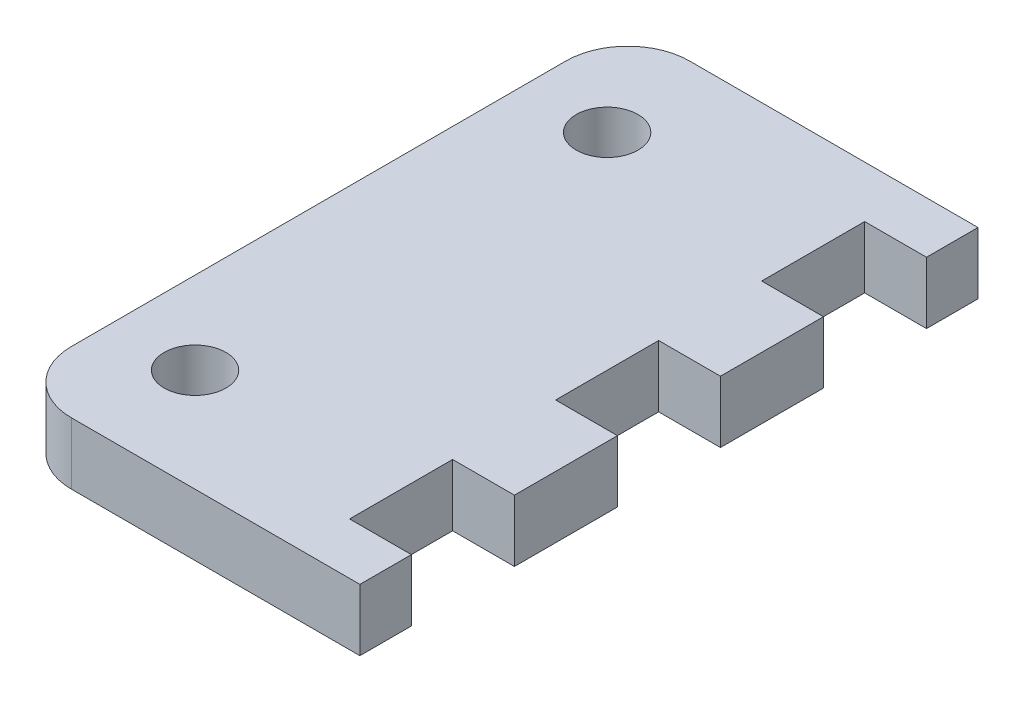
from build123d import *

# Parameters (mm, degrees)
SKETCH1_W           = 17
SKETCH1_H           = 30
BOSS_EXTRUDE1_DEPTH = 3
SKETCH2_W           = 3
SKETCH2_H           = 5
CUT_EXTRUDE1_DEPTH  = 3
SKETCH3_R           = 1.5
CUT_EXTRUDE2_DEPTH  = 3
FILLET1_R           = 3


with BuildPart() as part:
    # Sketch1 → Boss-Extrude1 (new body)
    with BuildSketch(Plane(origin=(0, 0, 0), x_dir=(1, 0, 0), z_dir=(0, 1, 0))):
        Rectangle(SKETCH1_W, SKETCH1_H)
    extrude(amount=BOSS_EXTRUDE1_DEPTH)

    # Sketch2 → Cut-Extrude1 (cut)
    with BuildSketch(Plane(origin=(0, 3, 0), x_dir=(1, 0, 0), z_dir=(0, 1, 0))):
        with Locations((7, 10)):
            Rectangle(SKETCH2_W, SKETCH2_H)
        with Locations((7, 0)):
            Rectangle(SKETCH2_W, SKETCH2_H)
        with Locations((7, -10)):
            Rectangle(SKETCH2_W, SKETCH2_H)
    extrude(amount=-CUT_EXTRUDE1_DEPTH, mode=Mode.SUBTRACT)

    # Sketch3 → Cut-Extrude2 (cut)
    with BuildSketch(Plane(origin=(0, 3, 0), x_dir=(1, 0, 0), z_dir=(0, 1, 0))):
        with Locations(Location((-4.5, 10, 0), (0, 0, 270))):
            Circle(SKETCH3_R)
        with Locations(Location((-4.5, -10, 0), (0, 0, 270))):
            Circle(SKETCH3_R)
    extrude(amount=-CUT_EXTRUDE2_DEPTH, mode=Mode.SUBTRACT)

    # Fillet1
    fillet1_edges = [part.edges().sort_by_distance(p)[0] for p in [
        (-8.5, 1.5, 15),
        (-8.5, 1.5, -15),
    ]]
    fillet(fillet1_edges, radius=FILLET1_R)


solid = part.part
